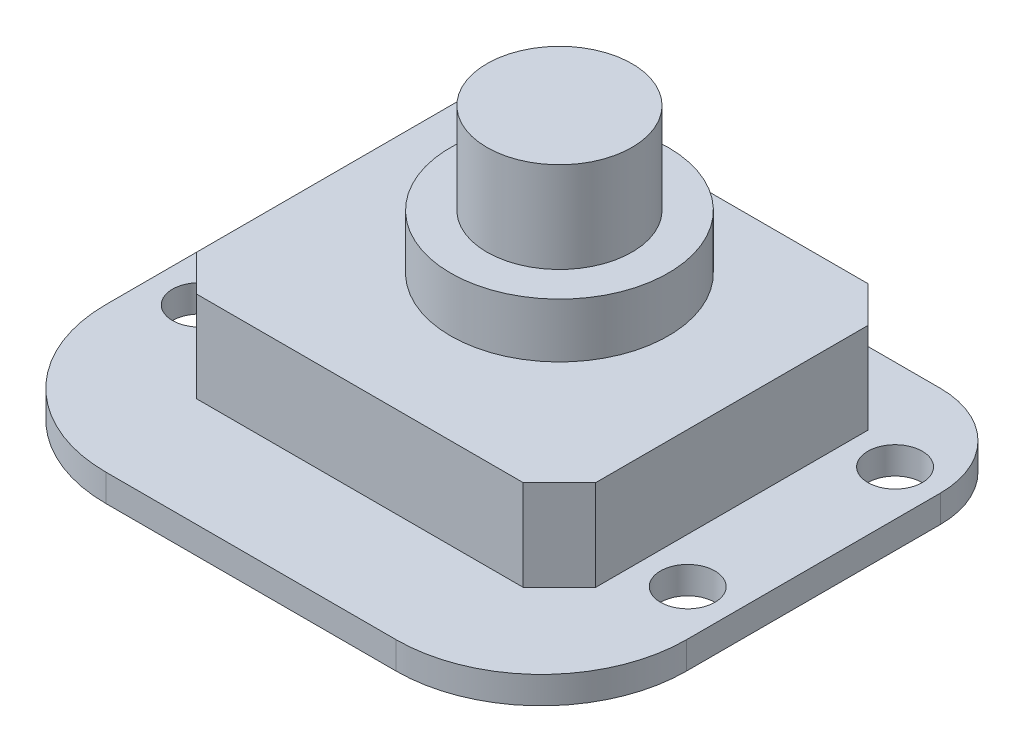
from build123d import *

# Parameters (mm, degrees)
SKETCH_1_R      = 1.5
EXTRUDE_1_DEPTH = 1.5
EXTRUDE_2_DEPTH = 5
SKETCH_3_R      = 6
EXTRUDE_3_DEPTH = 3
SKETCH_4_R      = 4
EXTRUDE_4_DEPTH = 5


with BuildPart() as part:
    # 草图1 → 凸台-拉伸1 (new body)
    with BuildSketch(Plane(origin=(0, 0, 0), x_dir=(1, 0, 0), z_dir=(0, 1, 0))):
        with BuildLine():
            Line((-11, 13.5), (11, 13.5))
            ThreePointArc((11, 13.5), (14.535533906, 12.035533906), (16, 8.5))
            Line((16, 8.5), (16, -5.5))
            ThreePointArc((16, -5.5), (13.656854249, -11.156854249), (8, -13.5))
            Line((8, -13.5), (-8, -13.5))
            ThreePointArc((-8, -13.5), (-13.656854249, -11.156854249), (-16, -5.5))
            Line((-16, -5.5), (-16, 8.5))
            ThreePointArc((-16, 8.5), (-14.535533906, 12.035533906), (-11, 13.5))
        make_face()
        with Locations(Location((-13.4, 8.5, 0), (0, 0, 270))):
            Circle(SKETCH_1_R, mode=Mode.SUBTRACT)
        with Locations(Location((13.5, 8.5, 0), (0, 0, 270))):
            Circle(SKETCH_1_R, mode=Mode.SUBTRACT)
        with Locations(Location((-13.4, -2.93, 0), (0, 0, 270))):
            Circle(SKETCH_1_R, mode=Mode.SUBTRACT)
        with Locations(Location((13.5, -2.93, 0), (0, 0, 270))):
            Circle(SKETCH_1_R, mode=Mode.SUBTRACT)
    extrude(amount=EXTRUDE_1_DEPTH)

    # 草图2 → 凸台-拉伸2 (add)
    with BuildSketch(Plane(origin=(0, 1.5, 0), x_dir=(1, 0, 0), z_dir=(0, 1, 0))):
        Polygon((-9, 11.5), (9, 11.5), (11, 9.5), (11, -5.5), (9, -7.5), (-9, -7.5), (-11, -5.5), (-11, 9.5), align=None)
    extrude(amount=EXTRUDE_2_DEPTH)

    # 草图3 → 凸台-拉伸3 (add)
    with BuildSketch(Plane(origin=(0, 6.5, 0), x_dir=(1, 0, 0), z_dir=(0, 1, 0))):
        with Locations(Location((0, 3.5, 0), (0, 0, 270))):
            Circle(SKETCH_3_R)
    extrude(amount=EXTRUDE_3_DEPTH)

    # 草图4 → 凸台-拉伸4 (add)
    with BuildSketch(Plane(origin=(0, 9.5, 0), x_dir=(1, 0, 0), z_dir=(0, 1, 0))):
        with Locations(Location((0, 3.5, 0), (0, 0, 270))):
            Circle(SKETCH_4_R)
    extrude(amount=EXTRUDE_4_DEPTH)


solid = part.part
